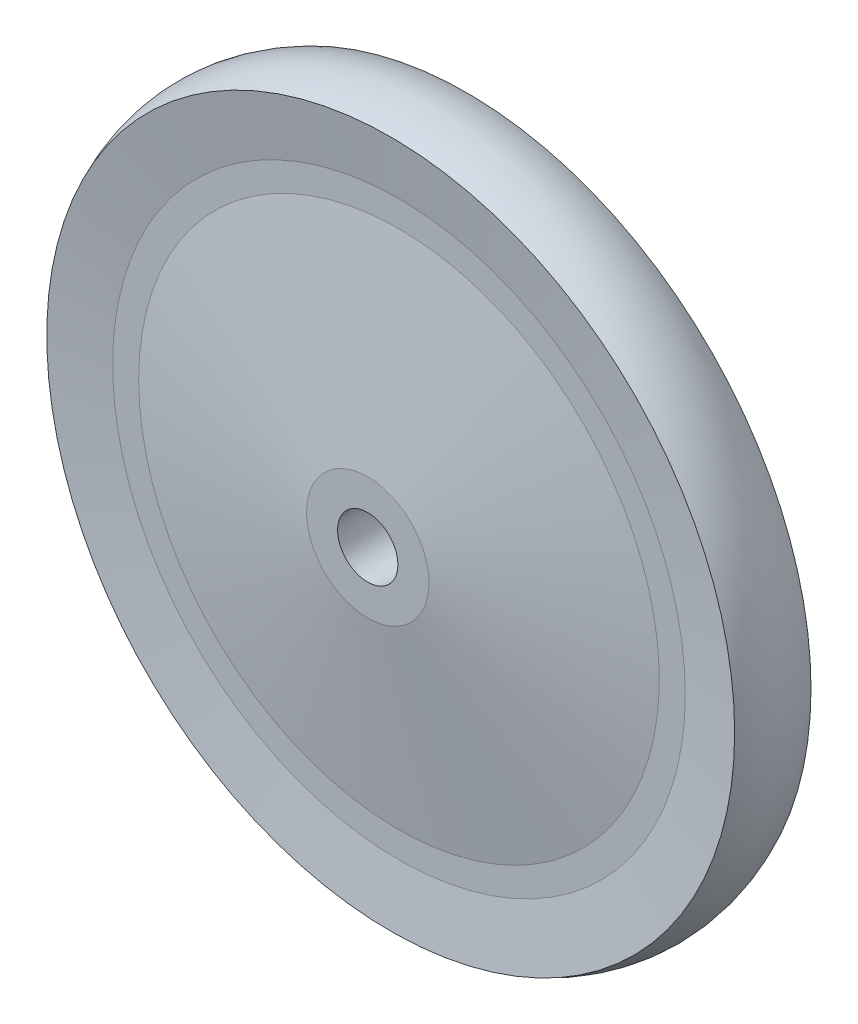
from build123d import *


with BuildPart() as part:
    # Sketch1 → Revolve1 (revolve)
    with BuildSketch(Plane(origin=(0, 0, 0), x_dir=(0, 0, -1), z_dir=(1, 0, 0)), mode=Mode.PRIVATE) as revolve1_sk:
        with BuildLine():
            Line((35.25, 35.25), (17.25, 150))
            Line((17.25, 150), (17.25, 165))
            Line((17.25, 165), (22, 198.2))
            ThreePointArc((22, 198.2), (0, 203.2), (-22, 198.2))
            Line((-22, 198.2), (-17.25, 165))
            Line((-17.25, 165), (-17.25, 150))
            Line((-17.25, 150), (-35.25, 35.25))
            Line((-35.25, 35.25), (-35.25, 17.375))
            Line((-35.25, 17.375), (35.25, 17.375))
            Line((35.25, 17.375), (35.25, 35.25))
        make_face()
    revolve(revolve1_sk.sketch.rotate(Axis((0, 0, 0), (0, 0, -1)), 90), axis=Axis((0, 0, 0), (0, 0, -1)))


solid = part.part
